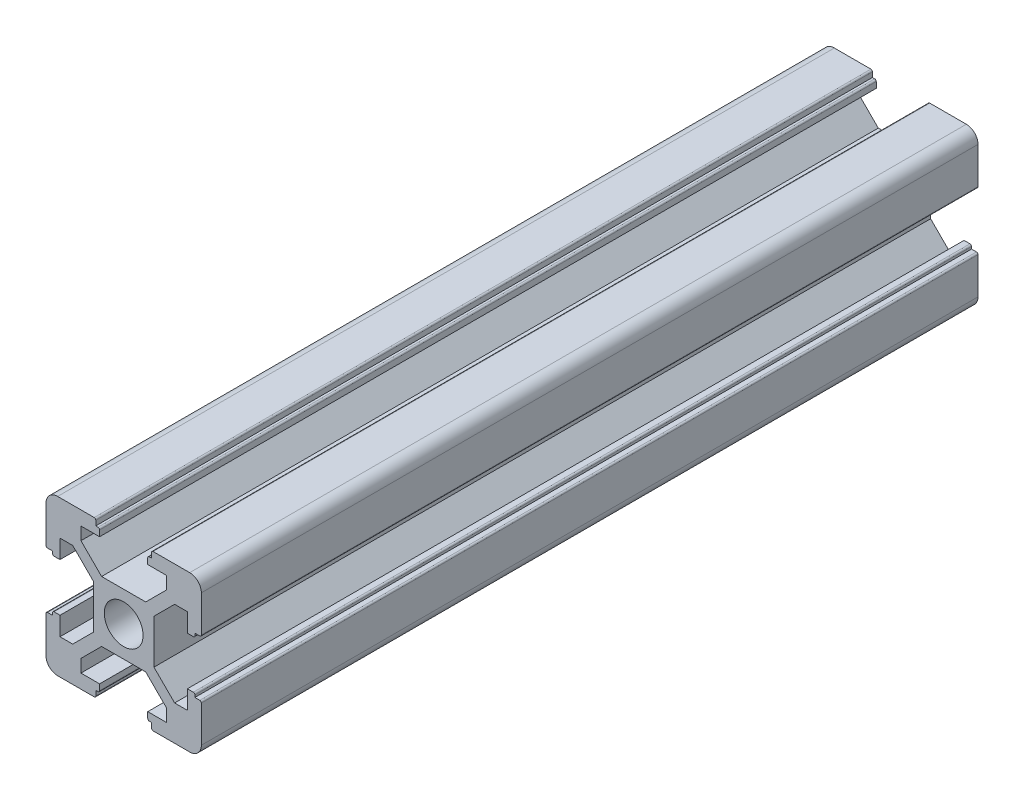
from build123d import *

# Parameters (mm, degrees)
SKETCH_1_R      = 2.5
EXTRUDE_1_DEPTH = 100


with BuildPart() as part:
    # 草图1 → 凸台-拉伸1 (new body)
    with BuildSketch(Plane.XY):
        with BuildLine():
            Line((2.839339828, 3.9), (5.5, 6.560660172))
            Line((5.5, 6.560660172), (5.5, 8.2))
            Line((5.5, 8.2), (3.1, 8.2))
            Line((3.1, 8.2), (3.1, 8.965473865))
            ThreePointArc((3.1, 8.965473865), (3.158578644, 9.106895221), (3.3, 9.165473865))
            Line((3.3, 9.165473865), (3.589843476, 9.165473865))
            Line((3.589843476, 9.165473865), (3.589843476, 9.8))
            ThreePointArc((3.589843476, 9.8), (3.64842212, 9.941421356), (3.789843476, 10))
            Line((3.789843476, 10), (8.5, 10))
            ThreePointArc((8.5, 10), (9.560660172, 9.560660172), (10, 8.5))
            Line((10, 8.5), (10, 3.789843476))
            ThreePointArc((10, 3.789843476), (9.941421356, 3.64842212), (9.8, 3.589843476))
            Line((9.8, 3.589843476), (9.165473865, 3.589843476))
            Line((9.165473865, 3.589843476), (9.165473865, 3.3))
            ThreePointArc((9.165473865, 3.3), (9.106895221, 3.158578644), (8.965473865, 3.1))
            Line((8.965473865, 3.1), (8.2, 3.1))
            Line((8.2, 3.1), (8.2, 5.5))
            Line((8.2, 5.5), (6.560660172, 5.5))
            Line((6.560660172, 5.5), (3.9, 2.839339828))
            Line((3.9, 2.839339828), (3.9, -2.839339828))
            Line((3.9, -2.839339828), (6.560660172, -5.5))
            Line((6.560660172, -5.5), (8.2, -5.5))
            Line((8.2, -5.5), (8.2, -3.1))
            Line((8.2, -3.1), (8.965473865, -3.1))
            ThreePointArc((8.965473865, -3.1), (9.106895221, -3.158578644), (9.165473865, -3.3))
            Line((9.165473865, -3.3), (9.165473865, -3.589843476))
            Line((9.165473865, -3.589843476), (9.8, -3.589843476))
            ThreePointArc((9.8, -3.589843476), (9.941421356, -3.64842212), (10, -3.789843476))
            Line((10, -3.789843476), (10, -8.5))
            ThreePointArc((10, -8.5), (9.560660172, -9.560660172), (8.5, -10))
            Line((8.5, -10), (3.789843476, -10))
            ThreePointArc((3.789843476, -10), (3.64842212, -9.941421356), (3.589843476, -9.8))
            Line((3.589843476, -9.8), (3.589843476, -9.165473865))
            Line((3.589843476, -9.165473865), (3.3, -9.165473865))
            ThreePointArc((3.3, -9.165473865), (3.158578644, -9.106895221), (3.1, -8.965473865))
            Line((3.1, -8.965473865), (3.1, -8.2))
            Line((3.1, -8.2), (5.5, -8.2))
            Line((5.5, -8.2), (5.5, -6.560660172))
            Line((5.5, -6.560660172), (2.839339828, -3.9))
            Line((2.839339828, -3.9), (-2.839339828, -3.9))
            Line((-2.839339828, -3.9), (-5.5, -6.560660172))
            Line((-5.5, -6.560660172), (-5.5, -8.2))
            Line((-5.5, -8.2), (-3.1, -8.2))
            Line((-3.1, -8.2), (-3.1, -8.965473865))
            ThreePointArc((-3.1, -8.965473865), (-3.158578644, -9.106895221), (-3.3, -9.165473865))
            Line((-3.3, -9.165473865), (-3.589843476, -9.165473865))
            Line((-3.589843476, -9.165473865), (-3.589843476, -9.8))
            ThreePointArc((-3.589843476, -9.8), (-3.64842212, -9.941421356), (-3.789843476, -10))
            Line((-3.789843476, -10), (-8.5, -10))
            ThreePointArc((-8.5, -10), (-9.560660172, -9.560660172), (-10, -8.5))
            Line((-10, -8.5), (-10, -3.789843476))
            ThreePointArc((-10, -3.789843476), (-9.941421356, -3.64842212), (-9.8, -3.589843476))
            Line((-9.8, -3.589843476), (-9.165473865, -3.589843476))
            Line((-9.165473865, -3.589843476), (-9.165473865, -3.3))
            ThreePointArc((-9.165473865, -3.3), (-9.106895221, -3.158578644), (-8.965473865, -3.1))
            Line((-8.965473865, -3.1), (-8.2, -3.1))
            Line((-8.2, -3.1), (-8.2, -5.5))
            Line((-8.2, -5.5), (-6.560660172, -5.5))
            Line((-6.560660172, -5.5), (-3.9, -2.839339828))
            Line((-3.9, -2.839339828), (-3.9, 2.839339828))
            Line((-3.9, 2.839339828), (-6.560660172, 5.5))
            Line((-6.560660172, 5.5), (-8.2, 5.5))
            Line((-8.2, 5.5), (-8.2, 3.1))
            Line((-8.2, 3.1), (-8.965473865, 3.1))
            ThreePointArc((-8.965473865, 3.1), (-9.106895221, 3.158578644), (-9.165473865, 3.3))
            Line((-9.165473865, 3.3), (-9.165473865, 3.589843476))
            Line((-9.165473865, 3.589843476), (-9.8, 3.589843476))
            ThreePointArc((-9.8, 3.589843476), (-9.941421356, 3.64842212), (-10, 3.789843476))
            Line((-10, 3.789843476), (-10, 8.5))
            ThreePointArc((-10, 8.5), (-9.560660172, 9.560660172), (-8.5, 10))
            Line((-8.5, 10), (-3.789843476, 10))
            ThreePointArc((-3.789843476, 10), (-3.64842212, 9.941421356), (-3.589843476, 9.8))
            Line((-3.589843476, 9.8), (-3.589843476, 9.165473865))
            Line((-3.589843476, 9.165473865), (-3.3, 9.165473865))
            ThreePointArc((-3.3, 9.165473865), (-3.158578644, 9.106895221), (-3.1, 8.965473865))
            Line((-3.1, 8.965473865), (-3.1, 8.2))
            Line((-3.1, 8.2), (-5.5, 8.2))
            Line((-5.5, 8.2), (-5.5, 6.560660172))
            Line((-5.5, 6.560660172), (-2.839339828, 3.9))
            Line((-2.839339828, 3.9), (2.839339828, 3.9))
        make_face()
        Circle(SKETCH_1_R, mode=Mode.SUBTRACT)
    extrude(amount=EXTRUDE_1_DEPTH)


solid = part.part
